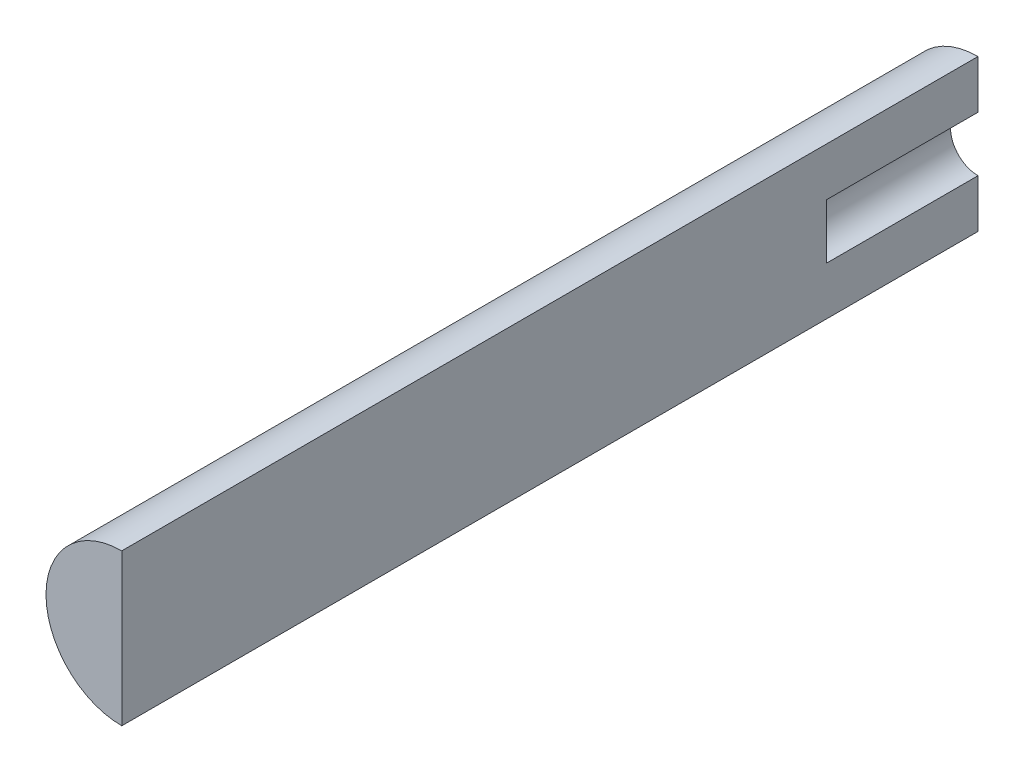
from build123d import *

# Parameters (mm, degrees)
SKETCH_1_R          = 4
EXTRUDE_1_DEPTH     = 45.2
SKETCH_4_R          = 1.45
CUT_EXTRUDE_3_DEPTH = 8
CUT_EXTRUDE_4_DEPTH = 60


with BuildPart() as part:
    # 草图1 → 凸台-拉伸1 (new body)
    with BuildSketch(Plane.XY):
        Circle(SKETCH_1_R)
    extrude(amount=EXTRUDE_1_DEPTH)

    # 草图4 → 切除-拉伸3 (cut)
    with BuildSketch(Plane(origin=(0, 0, 0), x_dir=(-1, 0, 0), z_dir=(0, 0, -1))):
        Circle(SKETCH_4_R)
    extrude(amount=-CUT_EXTRUDE_3_DEPTH, mode=Mode.SUBTRACT)

    # 草图5 → 切除-拉伸4 (cut)
    with BuildSketch(Plane(origin=(0, 0, 0), x_dir=(-1, 0, 0), z_dir=(0, 0, -1))):
        with BuildLine():
            Line((0, -4), (0, 4))
            ThreePointArc((0, 4), (-4, 0), (0, -4))
        make_face()
    extrude(amount=-CUT_EXTRUDE_4_DEPTH, mode=Mode.SUBTRACT)


solid = part.part
